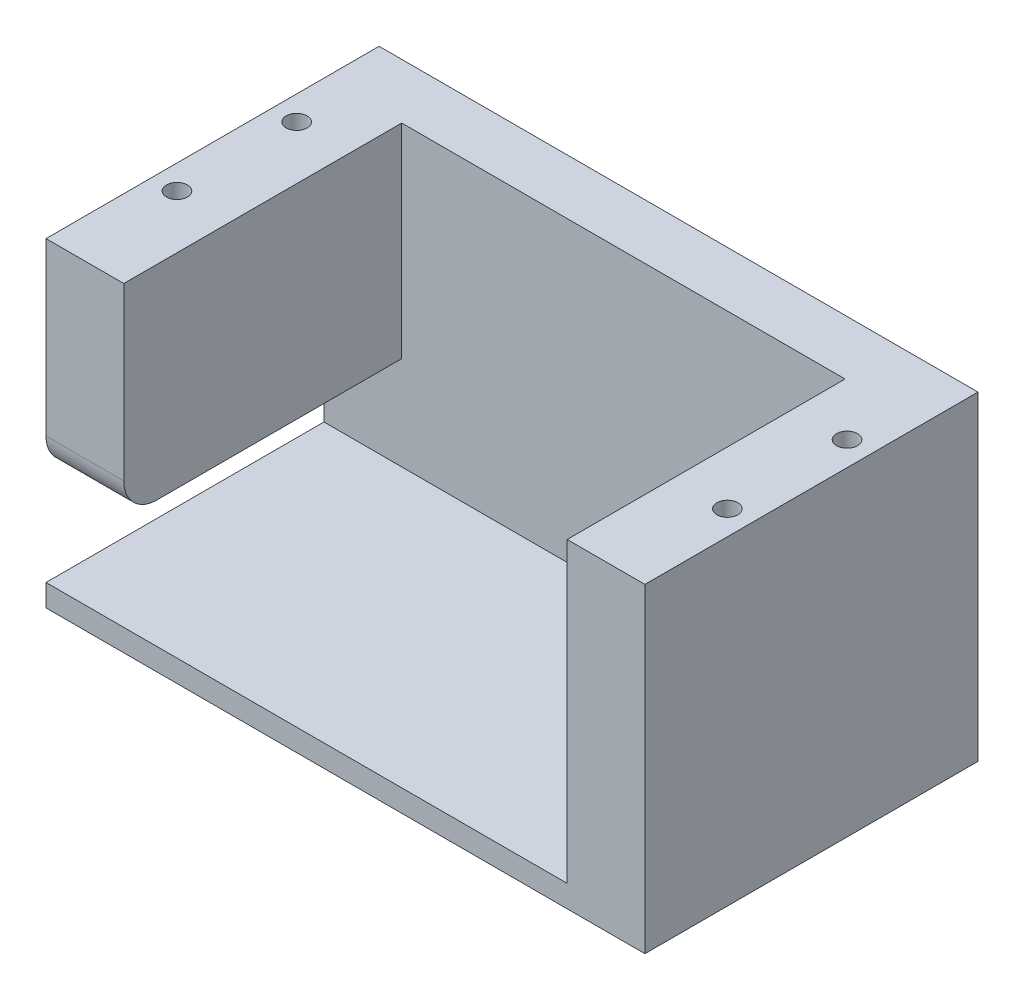
from build123d import *

# Parameters (mm, degrees)
BOSS_EXTRUDE1_DEPTH = 2
SKETCH7_W           = 54.3
SKETCH7_H           = 30.2
SKETCH7_W_2         = 40.2
SKETCH7_H_2         = 20.2
BOSS_EXTRUDE3_DEPTH = 27
SKETCH8_W           = 40.2
SKETCH8_H           = 5
CUT_EXTRUDE2_DEPTH  = 27
CUT_EXTRUDE3_REACH  = 61.157
SKETCH9_W           = 25.2
SKETCH9_H           = 8.5
SKETCH10_R          = 0.95
CUT_EXTRUDE4_DEPTH  = 10
FILLET1_R           = 3
CUT_EXTRUDE5_REACH  = 59.459


with BuildPart() as part:
    # Sketch1 → Boss-Extrude1 (new body)
    with BuildSketch(Plane(origin=(0, 0, 0), x_dir=(1, 0, 0), z_dir=(0, 1, 0))):
        Polygon((-27.15, 10.1), (-27.15, -10.1), (-27.15, -15.1), (27.15, -15.1), (27.15, -10.1), (27.15, 10.1), (27.15, 15.1), (-27.15, 15.1), align=None)
    extrude(amount=BOSS_EXTRUDE1_DEPTH)

    # Sketch7 → Boss-Extrude3 (add)
    with BuildSketch(Plane(origin=(0, 2, 0), x_dir=(1, 0, 0), z_dir=(0, 1, 0))):
        Rectangle(SKETCH7_W, SKETCH7_H)
        Rectangle(SKETCH7_W_2, SKETCH7_H_2, mode=Mode.SUBTRACT)
    extrude(amount=BOSS_EXTRUDE3_DEPTH)

    # Sketch8 → Cut-Extrude2 (cut)
    with BuildSketch(Plane(origin=(0, 29, 0), x_dir=(1, 0, 0), z_dir=(0, 1, 0))):
        with Locations((0, -12.6)):
            Rectangle(SKETCH8_W, SKETCH8_H)
    extrude(amount=-CUT_EXTRUDE2_DEPTH, mode=Mode.SUBTRACT)

    # Sketch9 → Cut-Extrude3 (cut, up to next)
    with BuildSketch(Plane(origin=(-22.15, 0, 0), x_dir=(0, 0, -1), z_dir=(1, 0, 0)), mode=Mode.PRIVATE) as cut_extrude3_sk1:
        with Locations((-2.5, 6.25)):
            Rectangle(SKETCH9_W, SKETCH9_H)
    cut_extrude3_tool1 = extrude(cut_extrude3_sk1.sketch, amount=-CUT_EXTRUDE3_REACH, mode=Mode.PRIVATE) & part.part
    add(cut_extrude3_tool1.solids().sort_by_distance((-22.15, 6.25, 2.5))[0], mode=Mode.SUBTRACT)

    # Sketch10 → Cut-Extrude4 (cut)
    with BuildSketch(Plane(origin=(0, 29, 0), x_dir=(1, 0, 0), z_dir=(0, 1, 0))):
        with Locations(Location((-24.95, -5.425, 0), (0, 0, 270))):
            Circle(SKETCH10_R)
        with Locations(Location((-24.95, 5.425, 0), (0, 0, 90))):
            Circle(SKETCH10_R)
        with Locations(Location((24.95, -5.425, 0), (0, 0, 90))):
            Circle(SKETCH10_R)
        with Locations(Location((24.95, 5.425, 0), (0, 0, 270))):
            Circle(SKETCH10_R)
    extrude(amount=-CUT_EXTRUDE4_DEPTH, mode=Mode.SUBTRACT)

    # Fillet1
    fillet1_edges = [part.edges().sort_by_distance(p)[0] for p in [
        (-24.65, 10.5, 15.1),
    ]]
    fillet(fillet1_edges, radius=FILLET1_R)

    # Sketch12 → Cut-Extrude5 (cut, up to next)
    with BuildSketch(Plane(origin=(-20.1, 0, 0), x_dir=(0, 0, -1), z_dir=(1, 0, 0)), mode=Mode.PRIVATE) as cut_extrude5_sk1:
        with BuildLine():
            Line((-15.1, 2), (10.1, 2))
            Line((10.1, 2), (10.1, 10.5))
            Line((10.1, 10.5), (-12.1, 10.5))
            ThreePointArc((-12.1, 10.5), (-14.221320344, 11.378679656), (-15.1, 13.5))
            Line((-15.1, 13.5), (-15.1, 2))
        make_face()
    cut_extrude5_tool1 = extrude(cut_extrude5_sk1.sketch, amount=-CUT_EXTRUDE5_REACH, mode=Mode.PRIVATE) & part.part
    add(cut_extrude5_tool1.solids().sort_by_distance((-20.1, 6.293968, 2.606609))[0], mode=Mode.SUBTRACT)


solid = part.part
